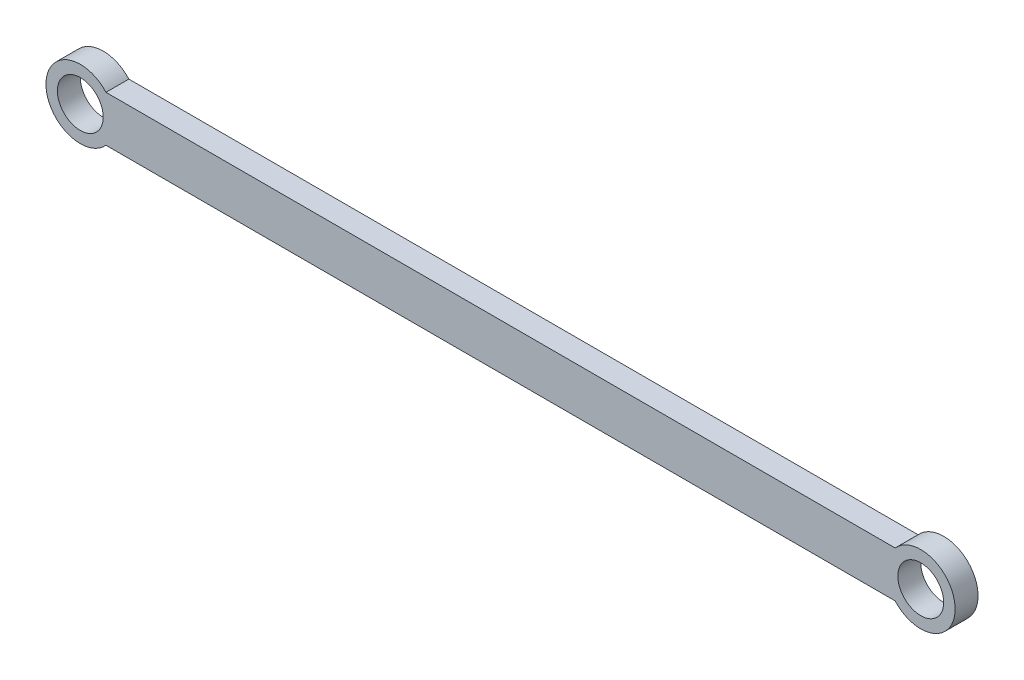
from build123d import *

# Parameters (mm, degrees)
SKETCH2_R           = 3
BOSS_EXTRUDE1_DEPTH = 3


with BuildPart() as part:
    # Sketch2 → Boss-Extrude1 (new body)
    with BuildSketch(Plane.XY):
        with BuildLine():
            Line((-3.354101966, -3), (-106.645898034, -3))
            ThreePointArc((-106.645898034, -3), (-114.5, 0), (-106.645898034, 3))
            Line((-106.645898034, 3), (-3.354101966, 3))
            ThreePointArc((-3.354101966, 3), (4.5, 0), (-3.354101966, -3))
        make_face()
        Circle(SKETCH2_R, mode=Mode.SUBTRACT)
        with Locations((-110, 0)):
            Circle(SKETCH2_R, mode=Mode.SUBTRACT)
    extrude(amount=BOSS_EXTRUDE1_DEPTH)


solid = part.part
